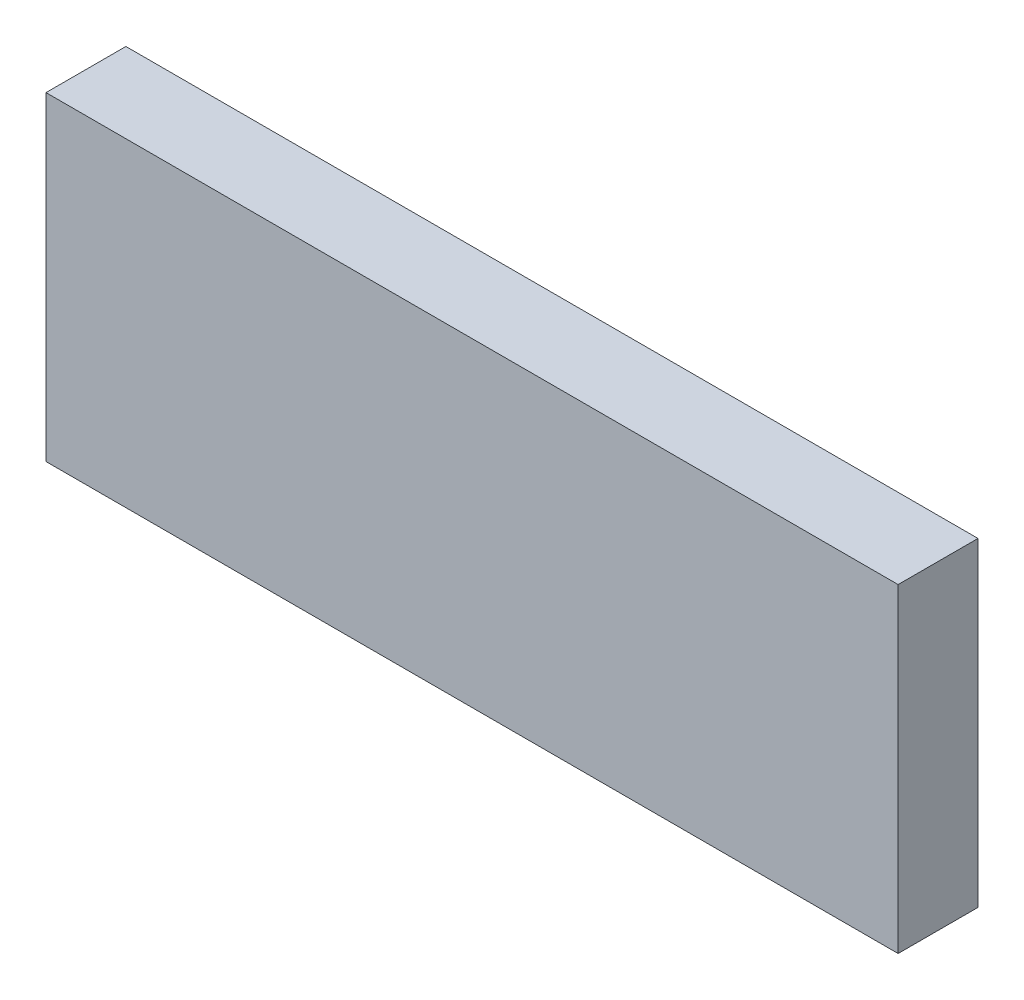
from build123d import *

# Parameters (mm, degrees)
SKETCH1_W           = 203.2
SKETCH1_H           = 76.2
BOSS_EXTRUDE1_DEPTH = 19.05


with BuildPart() as part:
    # Sketch1 → Boss-Extrude1 (new body)
    with BuildSketch(Plane.XY):
        with Locations((101.6, 38.1)):
            Rectangle(SKETCH1_W, SKETCH1_H)
    extrude(amount=BOSS_EXTRUDE1_DEPTH)


solid = part.part
